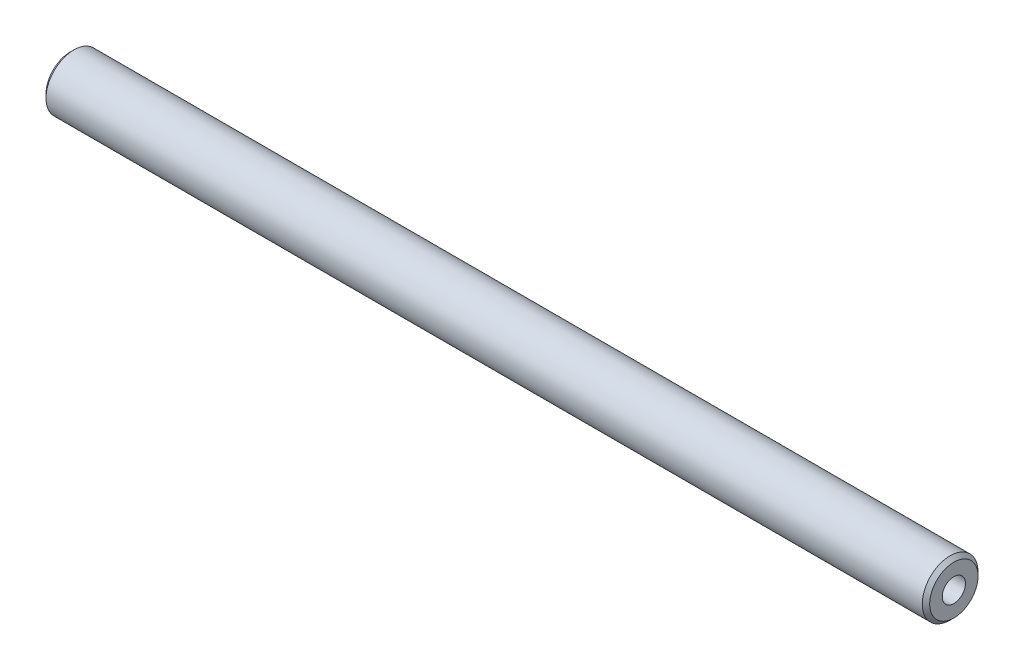
from build123d import *

# Parameters (mm, degrees)
SKETCH1_W           = 95
SKETCH1_H           = 3
CHAMFER1_SIZE       = 0.4
TAPPED_HOLE10_D     = 2.5
TAPPED_HOLE10_DEPTH = 8.5
TAPPED_HOLE10_TIP   = 0.751075774
TAPPED_HOLE11_D     = 2.5
TAPPED_HOLE11_DEPTH = 8.5
TAPPED_HOLE11_TIP   = 0.751075774


with BuildPart() as part:
    # Sketch1 → Revolve1 (revolve)
    with BuildSketch(Plane.XY):
        with Locations((47.5, 1.5)):
            Rectangle(SKETCH1_W, SKETCH1_H)
    revolve(axis=Axis((0, 0, 0), (1, 0, 0)))

    # Chamfer1
    chamfer1_edges = [part.edges().sort_by_distance(p)[0] for p in [
        (95, -3, 0),
        (0, -3, 0),
    ]]
    chamfer(chamfer1_edges, length=CHAMFER1_SIZE)

    # Tapped Hole10
    with Locations(Plane.ZY):
        with Locations((0, 0)):
            Hole(TAPPED_HOLE10_D / 2, depth=TAPPED_HOLE10_DEPTH)
            with Locations((0, 0, -(TAPPED_HOLE10_DEPTH + TAPPED_HOLE10_TIP / 2))):  # 118° drill point
                Cone(0, TAPPED_HOLE10_D / 2, TAPPED_HOLE10_TIP, mode=Mode.SUBTRACT)

    # Tapped Hole11
    with Locations(Plane(origin=(95, 0, 0), x_dir=(0, 0, -1), z_dir=(1, 0, 0))):
        with Locations((0, 0)):
            Hole(TAPPED_HOLE11_D / 2, depth=TAPPED_HOLE11_DEPTH)
            with Locations((0, 0, -(TAPPED_HOLE11_DEPTH + TAPPED_HOLE11_TIP / 2))):  # 118° drill point
                Cone(0, TAPPED_HOLE11_D / 2, TAPPED_HOLE11_TIP, mode=Mode.SUBTRACT)


solid = part.part
